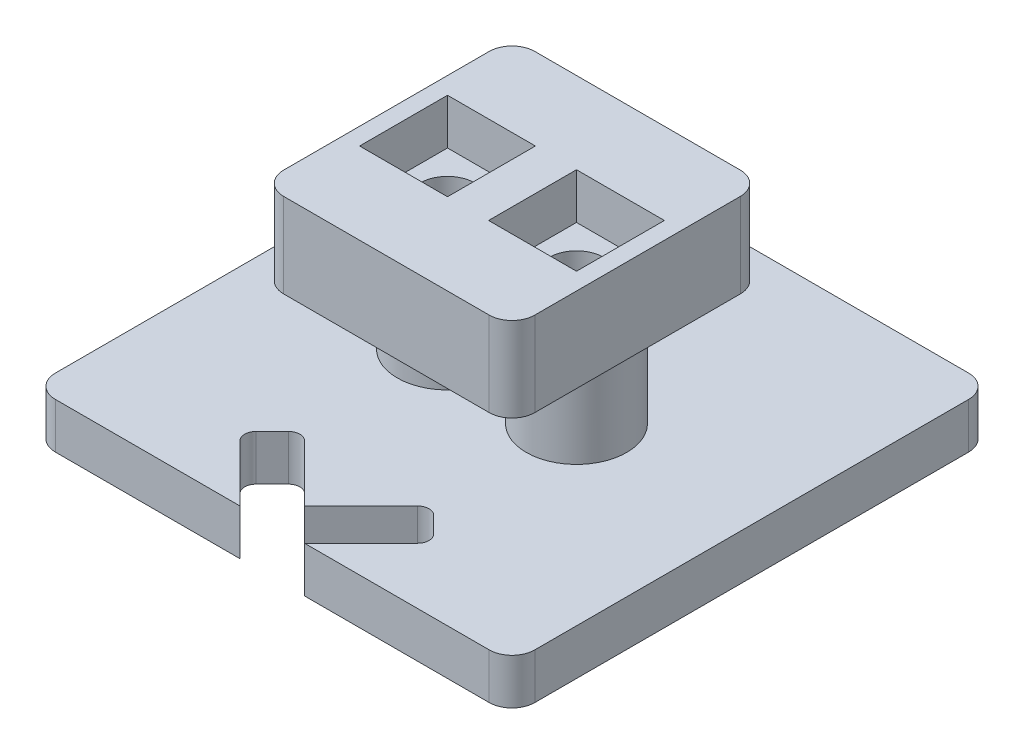
from build123d import *
from build123d.topology import SkipClean

# Parameters (mm, degrees)
SKETCH1_W           = 11
SKETCH1_H           = 11
BOSS_EXTRUDE1_DEPTH = 3.7
FILLET1_R           = 1
SKETCH2_W           = 3.85
SKETCH2_H           = 3.85
CUT_EXTRUDE1_DEPTH  = 2
SKETCH4_R           = 2.2
BOSS_EXTRUDE2_DEPTH = 6
BOSS_EXTRUDE3_DEPTH = 2
SKETCH3_R           = 1.2
CUT_EXTRUDE2_DEPTH  = 18.736685147
CUT_EXTRUDE3_DEPTH  = 17.726924403
SKETCH8_R           = 2.2
SKETCH8_R_2         = 1.2
BOSS_EXTRUDE4_DEPTH = 4


with BuildPart() as part:
    # Sketch1 → Boss-Extrude1 (new body)
    with BuildSketch(Plane(origin=(0, 0, 0), x_dir=(1, 0, 0), z_dir=(0, 1, 0))):
        Rectangle(SKETCH1_W, SKETCH1_H)
    extrude(amount=BOSS_EXTRUDE1_DEPTH)

    # Fillet1
    fillet1_edges = [part.edges().sort_by_distance(p)[0] for p in [
        (5.5, 1.85, 5.5),
        (-5.5, 1.85, 5.5),
        (-5.5, 1.85, -5.5),
        (5.5, 1.85, -5.5),
    ]]
    fillet(fillet1_edges, radius=FILLET1_R)

    # Sketch2 → Cut-Extrude1 (cut)
    with BuildSketch(Plane(origin=(0, 3.7, 0), x_dir=(1, 0, 0), z_dir=(0, 1, 0))):
        with Locations((-2.825, 0)):
            Rectangle(SKETCH2_W, SKETCH2_H)
        with Locations((2.825, 0)):
            Rectangle(SKETCH2_W, SKETCH2_H)
    extrude(amount=-CUT_EXTRUDE1_DEPTH, mode=Mode.SUBTRACT)

    # Sketch4 → Boss-Extrude2 (add)
    with BuildSketch(Plane(origin=(0, 0, 0), x_dir=(-1, 0, 0), z_dir=(0, -1, 0))):
        with Locations(Location((2.825, 0, 0), (0, 0, 90))):
            Circle(SKETCH4_R)
        with Locations(Location((-2.825, 0, 0), (0, 0, 90))):
            Circle(SKETCH4_R)
    extrude(amount=BOSS_EXTRUDE2_DEPTH)

    # Sketch5 → Boss-Extrude3 (add)
    with BuildSketch(Plane(origin=(0, -6, 0), x_dir=(-1, 0, 0), z_dir=(0, -1, 0))):
        with BuildLine():
            Line((9.5, 10.5), (-9.5, 10.5))
            ThreePointArc((-9.5, 10.5), (-10.207106781, 10.207106781), (-10.5, 9.5))
            Line((-10.5, 9.5), (-10.5, -9.5))
            ThreePointArc((-10.5, -9.5), (-10.207106781, -10.207106781), (-9.5, -10.5))
            Line((-9.5, -10.5), (9.5, -10.5))
            ThreePointArc((9.5, -10.5), (10.207106781, -10.207106781), (10.5, -9.5))
            Line((10.5, -9.5), (10.5, 9.5))
            ThreePointArc((10.5, 9.5), (10.207106781, 10.207106781), (9.5, 10.5))
        make_face()
    extrude(amount=-BOSS_EXTRUDE3_DEPTH)

    # Sketch3 → Cut-Extrude2 (cut, through all)
    with BuildSketch(Plane(origin=(0, 3.7, 0), x_dir=(1, 0, 0), z_dir=(0, 1, 0))):
        with Locations(Location((-2.825, 0, 0), (0, 0, 270))):
            Circle(SKETCH3_R)
        with Locations(Location((2.825, 0, 0), (0, 0, 270))):
            Circle(SKETCH3_R)
    extrude(amount=-CUT_EXTRUDE2_DEPTH, mode=Mode.SUBTRACT)

    # Sketch7 → Cut-Extrude3 (cut, through all)
    with BuildSketch(Plane(origin=(0, -4, 0), x_dir=(1, 0, 0), z_dir=(0, 1, 0))):
        with BuildLine():
            Line((0, -9.085786438), (1.414213562, -10.5))
            Line((1.414213562, -10.5), (3.889087297, -8.025126266))
            ThreePointArc((3.889087297, -8.025126266), (4.035533906, -7.671572875), (3.889087297, -7.318019485))
            Line((3.889087297, -7.318019485), (3.181980515, -6.610912703))
            ThreePointArc((3.181980515, -6.610912703), (2.828427125, -6.464466094), (2.474873734, -6.610912703))
            Line((2.474873734, -6.610912703), (0, -9.085786438))
        make_face()
        with BuildLine():
            Line((-3.889087297, -8.025126266), (-1.414213562, -10.5))
            Line((-1.414213562, -10.5), (0, -9.085786438))
            Line((0, -9.085786438), (-2.474873734, -6.610912703))
            ThreePointArc((-2.474873734, -6.610912703), (-2.828427125, -6.464466094), (-3.181980515, -6.610912703))
            Line((-3.181980515, -6.610912703), (-3.889087297, -7.318019485))
            ThreePointArc((-3.889087297, -7.318019485), (-4.035533906, -7.671572875), (-3.889087297, -8.025126266))
        make_face()
        Polygon((-1.414213562, -10.5), (1.414213562, -10.5), (0, -9.085786438), align=None)
    extrude(amount=-CUT_EXTRUDE3_DEPTH, mode=Mode.SUBTRACT)

    # Sketch8 → Boss-Extrude4 (add)
    # profile 1 of 2: a face of its own
    with SkipClean():  # the faces are left unmerged after this step: merging them gives an invalid solid
        with BuildSketch(Plane.XZ.offset(6)):
            with Locations(Location((-2.825, 0, 0), (0, 0, 90))):
                Circle(SKETCH8_R)
            with Locations(Location((-2.825, 0, 0), (0, 0, 270))):
                Circle(SKETCH8_R_2, mode=Mode.SUBTRACT)
        # profile 2 of 2: a face of its own
        with BuildSketch(Plane.XZ.offset(6)):
            with Locations(Location((2.825, 0, 0), (0, 0, 90))):
                Circle(SKETCH8_R)
            with Locations(Location((2.825, 0, 0), (0, 0, 270))):
                Circle(SKETCH8_R_2, mode=Mode.SUBTRACT)
        extrude(amount=BOSS_EXTRUDE4_DEPTH)


solid = part.part
